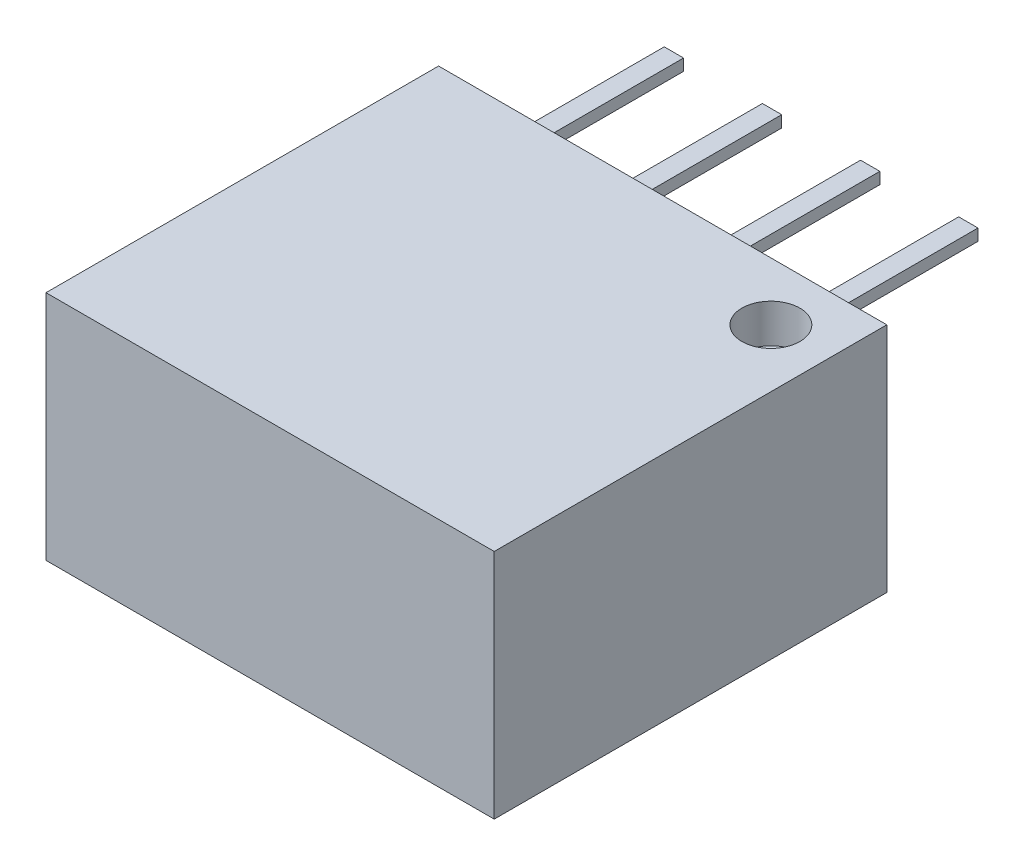
from build123d import *

# Parameters (mm, degrees)
SKETCH_1_W          = 11.6
SKETCH_1_H          = 6
EXTRUDE_1_DEPTH     = 10.16
SKETCH_2_W          = 0.5
SKETCH_2_H          = 0.3
EXTRUDE_2_DEPTH     = 4.1
EXTRUDE_2_2_DEPTH   = 4.1
EXTRUDE_2_3_DEPTH   = 4.1
EXTRUDE_2_4_DEPTH   = 4.1
SKETCH_3_R          = 0.75
CUT_EXTRUDE_1_DEPTH = 1


with BuildPart() as part:
    # 草图1 → 凸台-拉伸1 (new body)
    with BuildSketch(Plane.XY):
        Rectangle(SKETCH_1_W, SKETCH_1_H)
    extrude(amount=EXTRUDE_1_DEPTH)

    # 草图3 → 切除-拉伸1 (cut)
    with BuildSketch(Plane(origin=(0, 3, 0), x_dir=(1, 0, 0), z_dir=(0, 1, 0))):
        with Locations(Location((4.3, -1.5, 0), (0, 0, 270))):
            Circle(SKETCH_3_R)
    extrude(amount=-CUT_EXTRUDE_1_DEPTH, mode=Mode.SUBTRACT)


with BuildPart() as body_2:
    # 草图2 → 凸台-拉伸2 (new body)
    with BuildSketch(Plane(origin=(0, 0, 0), x_dir=(-1, 0, 0), z_dir=(0, 0, -1))):
        with Locations((-1.27, 2.1)):
            Rectangle(SKETCH_2_W, SKETCH_2_H)
    extrude(amount=EXTRUDE_2_DEPTH)


with BuildPart() as body_3:
    # 草图2 → Extrude 2 2 (new body)
    with BuildSketch(Plane(origin=(0, 0, 0), x_dir=(-1, 0, 0), z_dir=(0, 0, -1))):
        with Locations((-3.81, 2.1)):
            Rectangle(SKETCH_2_W, SKETCH_2_H)
    extrude(amount=EXTRUDE_2_2_DEPTH)


with BuildPart() as body_4:
    # 草图2 → Extrude 2 3 (new body)
    with BuildSketch(Plane(origin=(0, 0, 0), x_dir=(-1, 0, 0), z_dir=(0, 0, -1))):
        with Locations((1.27, 2.1)):
            Rectangle(SKETCH_2_W, SKETCH_2_H)
    extrude(amount=EXTRUDE_2_3_DEPTH)


with BuildPart() as body_5:
    # 草图2 → Extrude 2 4 (new body)
    with BuildSketch(Plane(origin=(0, 0, 0), x_dir=(-1, 0, 0), z_dir=(0, 0, -1))):
        with Locations((3.81, 2.1)):
            Rectangle(SKETCH_2_W, SKETCH_2_H)
    extrude(amount=EXTRUDE_2_4_DEPTH)


solid = Compound([part.part, body_2.part, body_3.part, body_4.part, body_5.part])
